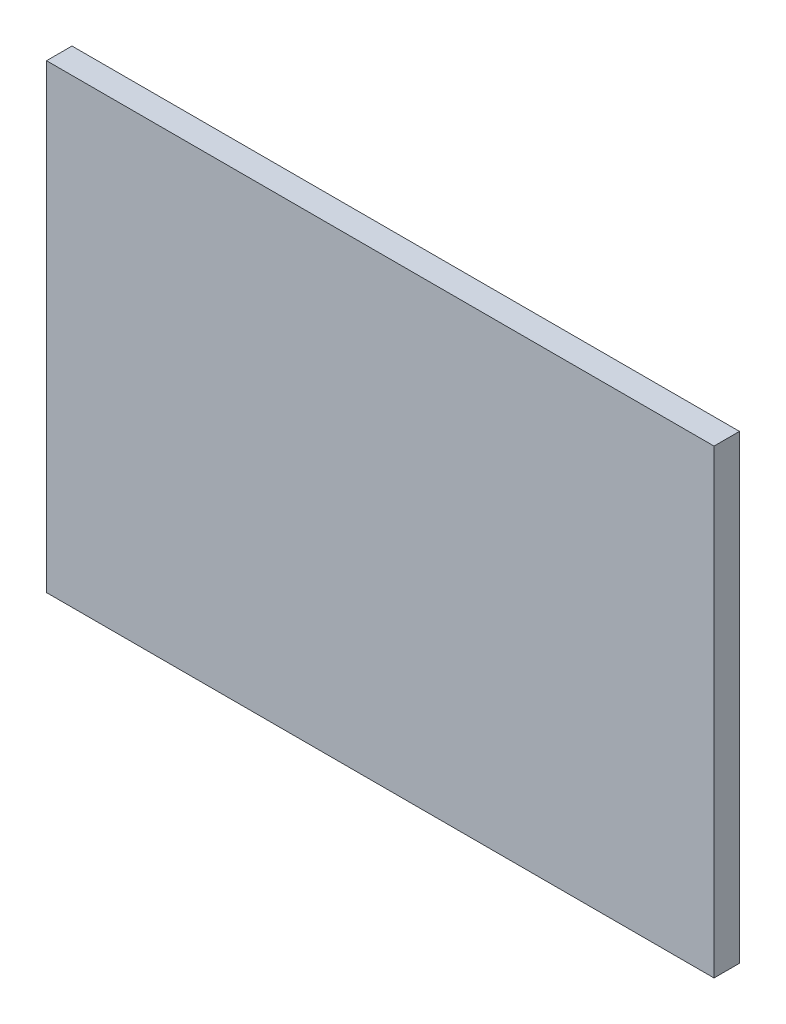
from build123d import *

# Parameters (mm, degrees)
IZIM1_W                     = 106.574044032
IZIM1_H                     = 73.551100811
Y_KSEKLIK_EKSTR_ZYON1_DEPTH = 4.064


with BuildPart() as part:
    # Çizim1 → Yükseklik-Ekstrüzyon1 (new body)
    with BuildSketch(Plane.XY):
        with Locations((-21.062373536, 9.131344149)):
            Rectangle(IZIM1_W, IZIM1_H)
    extrude(amount=Y_KSEKLIK_EKSTR_ZYON1_DEPTH)


solid = part.part
